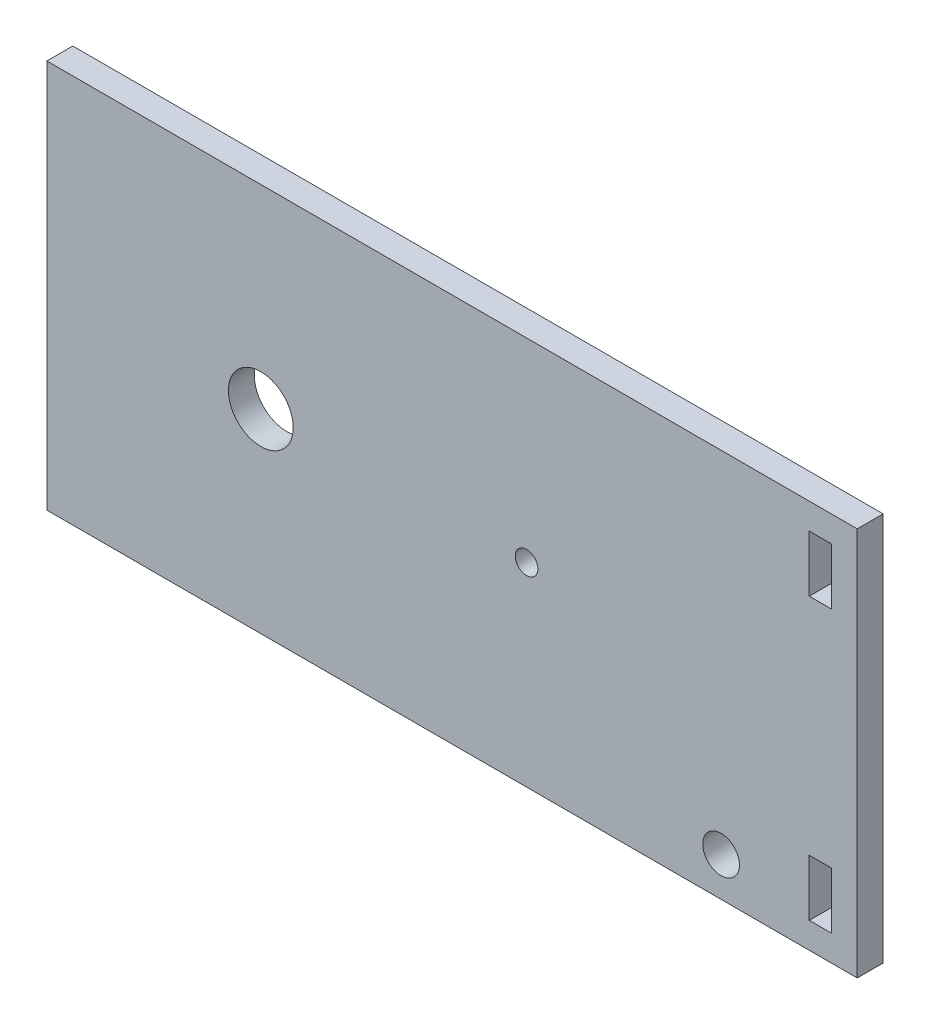
from build123d import *

# Parameters (mm, degrees)
SKETCH1_W               = 121
SKETCH1_H               = 60
SKETCH1_R               = 5
SKETCH1_R_2             = 2.83
BOSS_EXTRUDE1_DEPTH     = 4
SKETCH2_W               = 4
SKETCH2_H               = 60
BOSS_EXTRUDE2_DEPTH     = 4
CUT_EXTRUDE1_DEPTH      = 87.469647854
CUT_EXTRUDE1_DEPTH_BACK = 87.469647854
SKETCH3_R               = 1.75
SKETCH3_W               = 3.4
SKETCH3_H               = 8.7


with BuildPart() as part:
    # Sketch1 → Boss-Extrude1 (new body)
    with BuildSketch(Plane.XY):
        with Locations((-20.5, 0)):
            Rectangle(SKETCH1_W, SKETCH1_H)
        with Locations((-48, 0)):
            Circle(SKETCH1_R, mode=Mode.SUBTRACT)
        with Locations((23, -24)):
            Circle(SKETCH1_R_2, mode=Mode.SUBTRACT)
    extrude(amount=BOSS_EXTRUDE1_DEPTH)

    # Sketch2 → Boss-Extrude2 (add)
    with BuildSketch(Plane.XY):
        with Locations((42, 0)):
            Rectangle(SKETCH2_W, SKETCH2_H)
    extrude(amount=BOSS_EXTRUDE2_DEPTH)

    # Sketch3 → Cut-Extrude1 (cut, two sides: drawn at the far end of the back side and taken through both)
    with BuildSketch(Plane.XY.offset(-CUT_EXTRUDE1_DEPTH_BACK)):
        with Locations((-7, 0)):
            Circle(SKETCH3_R)
        with Locations((38.3, 21.65)):
            Rectangle(SKETCH3_W, SKETCH3_H)
        with Locations((38.3, -21.65)):
            Rectangle(SKETCH3_W, SKETCH3_H)
    extrude(amount=CUT_EXTRUDE1_DEPTH + CUT_EXTRUDE1_DEPTH_BACK, mode=Mode.SUBTRACT)


solid = part.part
